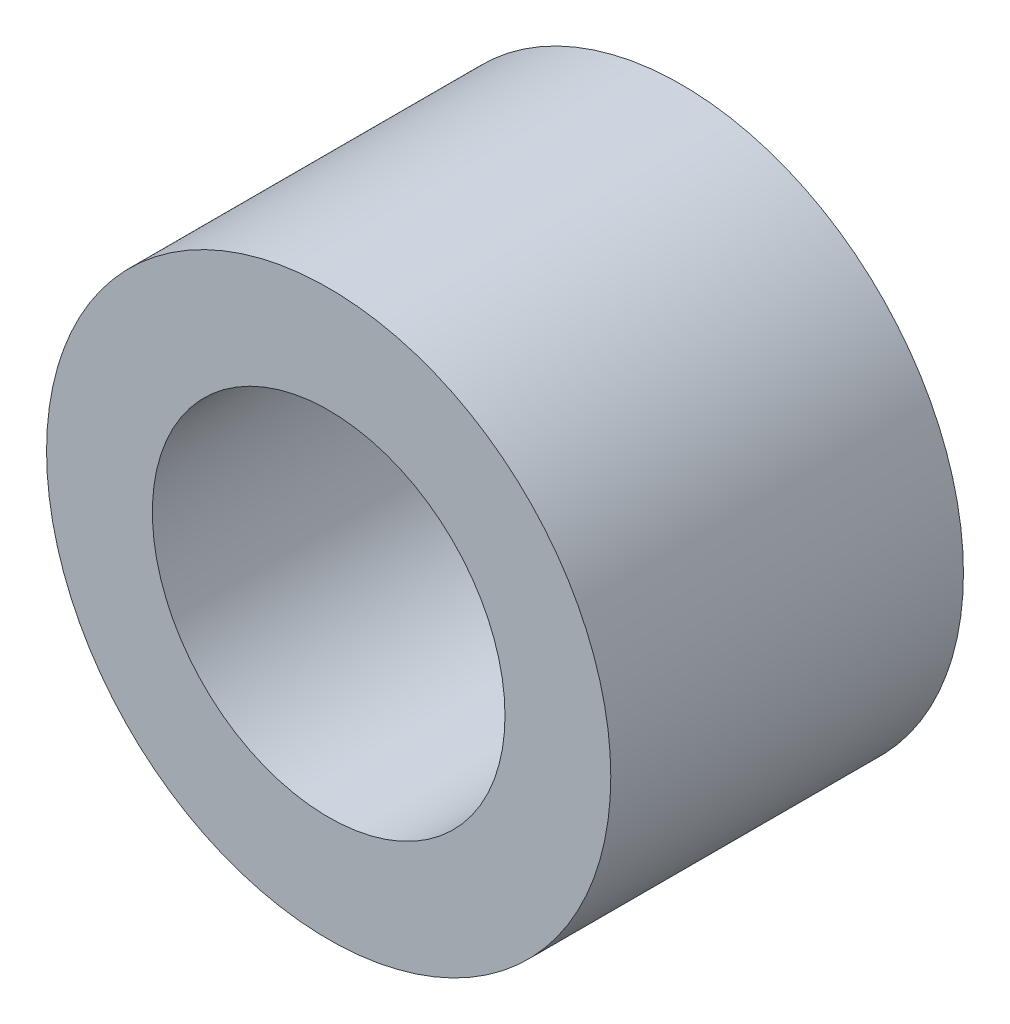
from build123d import *

# Parameters (mm, degrees)
ESQUISSE1_R        = 4
ESQUISSE1_R_2      = 2.5
BOSS_EXTRU_1_DEPTH = 5


with BuildPart() as part:
    # Esquisse1 → Boss.-Extru.1 (new body)
    with BuildSketch(Plane.XY):
        Circle(ESQUISSE1_R)
        Circle(ESQUISSE1_R_2, mode=Mode.SUBTRACT)
    extrude(amount=BOSS_EXTRU_1_DEPTH)


solid = part.part
